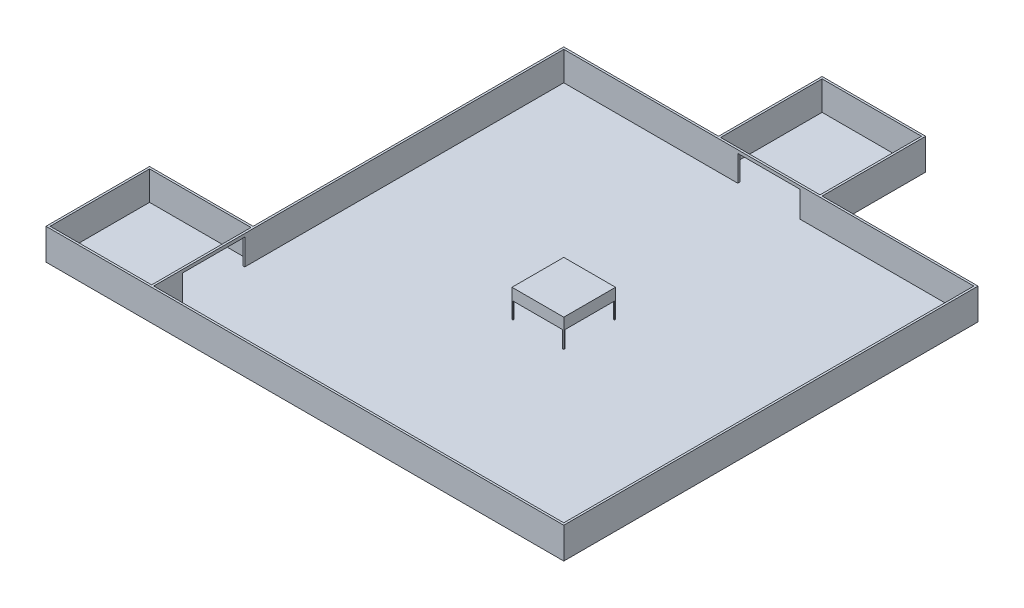
from build123d import *

# Parameters (mm, degrees)
SKETCH_1_W           = 4000
SKETCH_1_H           = 4000
EXTRUDE_1_DEPTH      = 300
SKETCH_2_W           = 3960
SKETCH_2_H           = 3960
CUT_EXTRUDE_1_DEPTH  = 280
SKETCH_3_W           = 600
SKETCH_3_H           = 250
CUT_EXTRUDE_2_DEPTH  = 20
SKETCH_5_W           = 600
SKETCH_5_H           = 250
CUT_EXTRUDE_3_DEPTH  = 20
SKETCH_6_W           = 500
SKETCH_6_H           = 500
EXTRUDE_2_DEPTH      = 270
SKETCH_8_W           = 480
SKETCH_8_H           = 160
CUT_EXTRUDE_4_DEPTH  = 500
SKETCH_11_W          = 480
SKETCH_11_H          = 160
CUT_EXTRUDE_5_DEPTH  = 500
EXTRUDE_3_DEPTH      = 280
EXTRUDE_3_DEPTH_BACK = 20
SKETCH_12_W          = 1000
SKETCH_12_H          = 1000
SKETCH_13_W          = 980
SKETCH_13_H          = 960
SKETCH_13_W_2        = 960
SKETCH_13_H_2        = 980
CUT_EXTRUDE_6_DEPTH  = 280


with BuildPart() as part:
    # 草图1 → 凸台-拉伸1 (new body)
    with BuildSketch(Plane(origin=(0, 0, 0), x_dir=(1, 0, 0), z_dir=(0, 1, 0))):
        with Locations((2000, 2000)):
            Rectangle(SKETCH_1_W, SKETCH_1_H)
    extrude(amount=EXTRUDE_1_DEPTH)

    # 草图2 → 切除-拉伸1 (cut)
    with BuildSketch(Plane(origin=(0, 300, 0), x_dir=(1, 0, 0), z_dir=(0, 1, 0))):
        with Locations((2000, 2000)):
            Rectangle(SKETCH_2_W, SKETCH_2_H)
    extrude(amount=-CUT_EXTRUDE_1_DEPTH, mode=Mode.SUBTRACT)

    # 草图3 → 切除-拉伸2 (cut)
    with BuildSketch(Plane(origin=(0, 0, -4000), x_dir=(-1, 0, 0), z_dir=(0, 0, -1))):
        with Locations((-2000, 145)):
            Rectangle(SKETCH_3_W, SKETCH_3_H)
    extrude(amount=-CUT_EXTRUDE_2_DEPTH, mode=Mode.SUBTRACT)

    # 草图5 → 切除-拉伸3 (cut)
    with BuildSketch(Plane.ZY):
        with Locations((-600, 145)):
            Rectangle(SKETCH_5_W, SKETCH_5_H)
    extrude(amount=-CUT_EXTRUDE_3_DEPTH, mode=Mode.SUBTRACT)

    # 草图6 → 凸台-拉伸2 (add)
    with BuildSketch(Plane(origin=(0, 20, 0), x_dir=(1, 0, 0), z_dir=(0, 1, 0))):
        with Locations((2000, 2000)):
            Rectangle(SKETCH_6_W, SKETCH_6_H)
    extrude(amount=EXTRUDE_2_DEPTH)

    # 草图8 → 切除-拉伸4 (cut)
    with BuildSketch(Plane.XY.offset(-1750)):
        with Locations((2000, 100)):
            Rectangle(SKETCH_8_W, SKETCH_8_H)
    extrude(amount=-CUT_EXTRUDE_4_DEPTH, mode=Mode.SUBTRACT)

    # 草图11 → 切除-拉伸5 (cut)
    with BuildSketch(Plane.ZY.offset(-1750)):
        with Locations((-2000, 100)):
            Rectangle(SKETCH_11_W, SKETCH_11_H)
    extrude(amount=-CUT_EXTRUDE_5_DEPTH, mode=Mode.SUBTRACT)

    # 草图12 → 凸台-拉伸3 (add, two sides: drawn at the far end of the back side and taken through both)
    with BuildSketch(Plane(origin=(0, 20, 0), x_dir=(1, 0, 0), z_dir=(0, 1, 0)).offset(-EXTRUDE_3_DEPTH_BACK)):
        with Locations((-500, 500)):
            Rectangle(SKETCH_12_W, SKETCH_12_H)
        with Locations((1994.423170097, 4500)):
            Rectangle(SKETCH_12_W, SKETCH_12_H)
    extrude(amount=EXTRUDE_3_DEPTH + EXTRUDE_3_DEPTH_BACK)

    # 草图13 → 切除-拉伸6 (cut)
    with BuildSketch(Plane(origin=(0, 300, 0), x_dir=(1, 0, 0), z_dir=(0, 1, 0))):
        with Locations((-490, 500)):
            Rectangle(SKETCH_13_W, SKETCH_13_H)
        with Locations((1994.423170097, 4490)):
            Rectangle(SKETCH_13_W_2, SKETCH_13_H_2)
    extrude(amount=-CUT_EXTRUDE_6_DEPTH, mode=Mode.SUBTRACT)


solid = part.part
